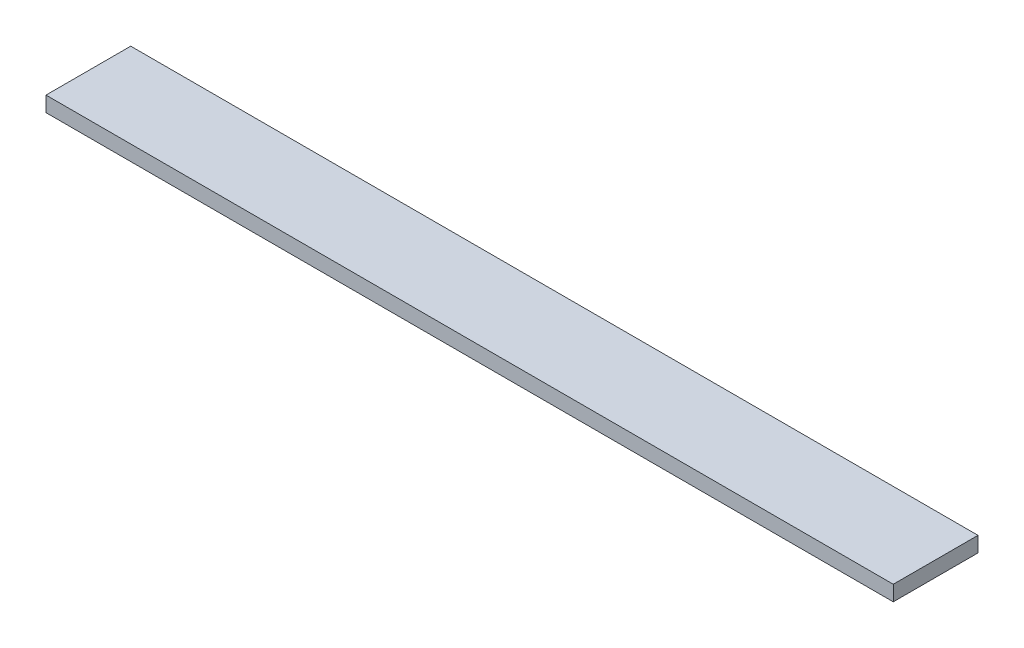
from build123d import *

# Parameters (mm, degrees)
ESQUISSE1_W        = 1000
ESQUISSE1_H        = 100
BOSS_EXTRU_1_DEPTH = 18


with BuildPart() as part:
    # Esquisse1 → Boss.-Extru.1 (new body)
    with BuildSketch(Plane(origin=(0, 0, 0), x_dir=(1, 0, 0), z_dir=(0, 1, 0))):
        Rectangle(ESQUISSE1_W, ESQUISSE1_H)
    extrude(amount=BOSS_EXTRU_1_DEPTH)


solid = part.part
